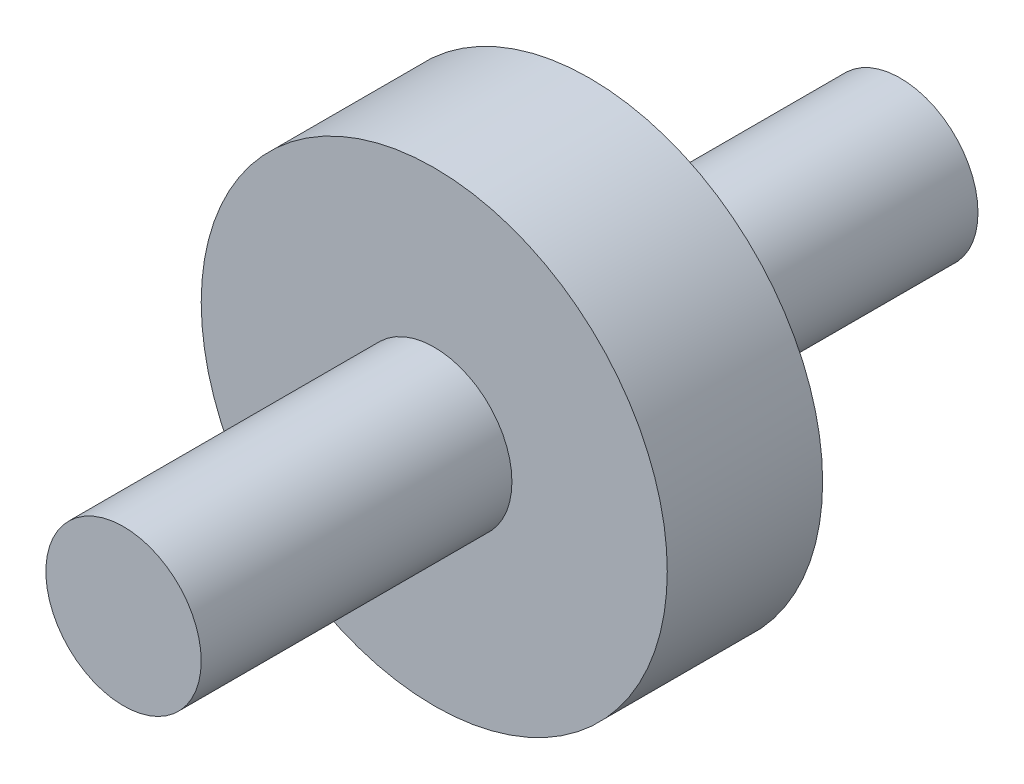
from build123d import *

# Parameters (mm, degrees)
SKETCH1_R                = 15
BOSS_EXTRUDE1_DEPTH      = 10
BOSS_EXTRUDE2_DEPTH      = 30
BOSS_EXTRUDE2_DEPTH_BACK = 20
SKETCH2_R                = 5


with BuildPart() as part:
    # Sketch1 → Boss-Extrude1 (new body)
    with BuildSketch(Plane.XY):
        Circle(SKETCH1_R)
    extrude(amount=BOSS_EXTRUDE1_DEPTH)

    # Sketch2 → Boss-Extrude2 (add, two sides: drawn at the far end of the back side and taken through both)
    with BuildSketch(Plane.XY.offset(-BOSS_EXTRUDE2_DEPTH_BACK)):
        Circle(SKETCH2_R)
    extrude(amount=BOSS_EXTRUDE2_DEPTH + BOSS_EXTRUDE2_DEPTH_BACK)


solid = part.part
